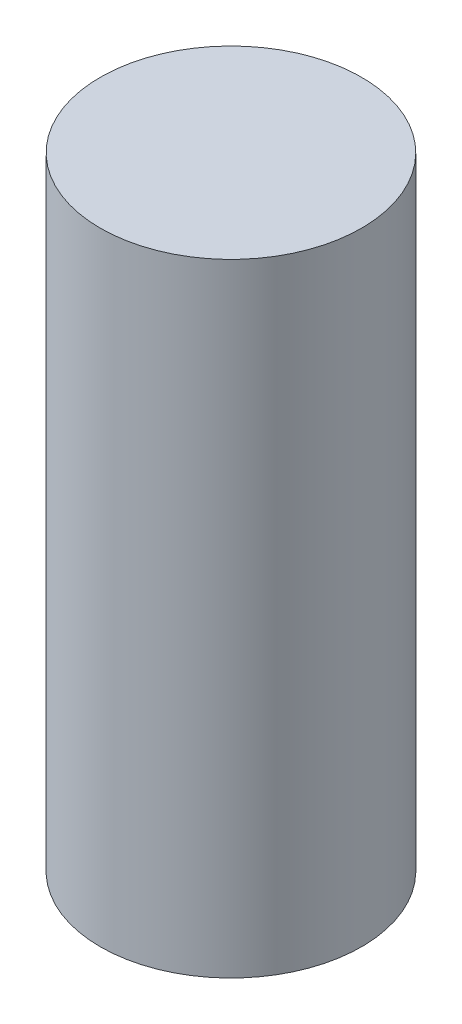
from build123d import *

# Parameters (mm, degrees)
ESQUISSE1_R        = 5.25
BOSS_EXTRU_1_DEPTH = 25


with BuildPart() as part:
    # Esquisse1 → Boss.-Extru.1 (new body)
    with BuildSketch(Plane(origin=(0, 0, 0), x_dir=(1, 0, 0), z_dir=(0, 1, 0))):
        with Locations(Location((0, 0, 0), (0, 0, 270))):
            Circle(ESQUISSE1_R)
    extrude(amount=BOSS_EXTRU_1_DEPTH)


solid = part.part
